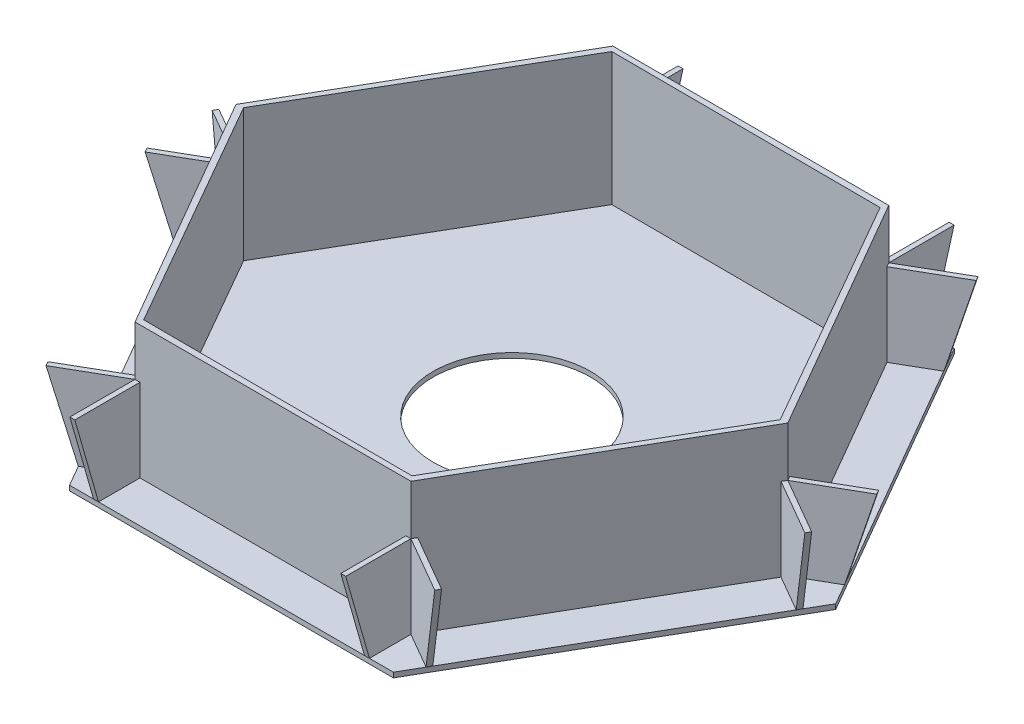
from build123d import *

# Parameters (mm, degrees)
EXTRUDE_2_DEPTH     = 3
SKETCH_4_R          = 47.5
CUT_EXTRUDE_1_DEPTH = 3
EXTRUDE_3_DEPTH     = 80
EXTRUDE_7_DEPTH     = 3
EXTRUDE_11_DEPTH    = 3
EXTRUDE_12_DEPTH    = 3
EXTRUDE_13_DEPTH    = 3
EXTRUDE_14_DEPTH    = 3
EXTRUDE_15_DEPTH    = 3
EXTRUDE_16_DEPTH    = 3
EXTRUDE_17_DEPTH    = 3
EXTRUDE_18_DEPTH    = 3
EXTRUDE_19_DEPTH    = 3
EXTRUDE_20_DEPTH    = 3
EXTRUDE_21_DEPTH    = 3


with BuildPart() as part:
    # 草图3 → 凸台-拉伸2 (new body)
    with BuildSketch(Plane(origin=(0, 0, 0), x_dir=(1, 0, 0), z_dir=(0, 1, 0))):
        Polygon((195.4, 0), (97.7, 169.221363899), (-97.7, 169.221363899), (-195.4, 0), (-97.7, -169.221363899), (97.7, -169.221363899), align=None)
    extrude(amount=EXTRUDE_2_DEPTH)

    # 草图4 → 切除-拉伸1 (cut)
    with BuildSketch(Plane(origin=(0, 3, 0), x_dir=(1, 0, 0), z_dir=(0, 1, 0))):
        with Locations(Location((0, 0, 0), (0, 0, 270))):
            Circle(SKETCH_4_R)
    extrude(amount=-CUT_EXTRUDE_1_DEPTH, mode=Mode.SUBTRACT)

    # 草图5 → 凸台-拉伸3 (add)
    with BuildSketch(Plane(origin=(0, 3, 0), x_dir=(1, 0, 0), z_dir=(0, 1, 0))):
        Polygon((83.24, 144.175909222), (-83.24, 144.175909222), (-166.48, 0), (-83.24, -144.175909222), (83.24, -144.175909222), (166.48, 0), align=None)
        Polygon((-80.729537332, 141.005291398), (-162.478933084, 0.588815534), (-81.749395753, -140.416475864), (80.729537332, -141.005291398), (162.478933084, -0.588815534), (81.749395753, 140.416475864), align=None, mode=Mode.SUBTRACT)
    extrude(amount=EXTRUDE_3_DEPTH)

    # 草图11 → 凸台-拉伸7 (add)
    with BuildSketch(Plane(origin=(83.24, 0, 0), x_dir=(0, 0, -1), z_dir=(1, 0, 0))):
        Polygon((144.175909222, 3), (144.175909222, 53), (183.582235223, 53), (169.299378366, 3), align=None)
    extrude(amount=-EXTRUDE_7_DEPTH)

    # 草图15 → 凸台-拉伸11 (add)
    with BuildSketch(Plane(origin=(-41.62, 0, -72.087954611), x_dir=(-0.8660254037844382, 0, 0.500000000000001), z_dir=(-0.500000000000001, 0, -0.8660254037844382))):
        Polygon((-144.175909222, 53), (-144.175909222, 3), (-169.299052365, 3), (-183.581909222, 53), align=None)
    extrude(amount=-EXTRUDE_11_DEPTH)

    # 草图17 → 凸台-拉伸12 (add)
    with BuildSketch(Plane(origin=(-41.62, 0, -72.087954611), x_dir=(-0.8660254037844382, 0, 0.500000000000001), z_dir=(-0.500000000000001, 0, -0.8660254037844382))):
        Polygon((144.175909222, 3), (169.221363899, 3), (183.504220757, 53), (144.175909222, 53), align=None)
    extrude(amount=-EXTRUDE_12_DEPTH)

    # 草图19 → 凸台-拉伸13 (add)
    with BuildSketch(Plane(origin=(83.24, 0, 0), x_dir=(0, 0, -1), z_dir=(1, 0, 0))):
        Polygon((-144.175909222, 3), (-144.175909222, 53), (-183.495909222, 53), (-169.213052365, 3), align=None)
    extrude(amount=-EXTRUDE_13_DEPTH)

    # 草图20 → 凸台-拉伸14 (add)
    with BuildSketch(Plane(origin=(-83.24, 0, 0), x_dir=(0, 0, -1), z_dir=(1, 0, 0))):
        Polygon((144.175909222, 3), (144.175909222, 53), (183.495909222, 53), (169.213052365, 3), align=None)
    extrude(amount=EXTRUDE_14_DEPTH)

    # 草图22 → 凸台-拉伸15 (add)
    with BuildSketch(Plane(origin=(-83.24, 0, 0), x_dir=(0, 0, -1), z_dir=(1, 0, 0))):
        Polygon((-144.175909222, 53), (-144.175909222, 3), (-169.213052365, 3), (-183.495909222, 53), align=None)
    extrude(amount=EXTRUDE_15_DEPTH)

    # 草图23 → 凸台-拉伸16 (add)
    with BuildSketch(Plane(origin=(-41.62, 0, 72.087954611), x_dir=(-0.8660254037844406, 0, -0.4999999999999966), z_dir=(0.4999999999999966, 0, -0.8660254037844406))):
        Polygon((-144.175909222, 53), (-144.175909222, 3), (-169.091328291, 3), (-183.495909222, 52.96506828), align=None)
    extrude(amount=EXTRUDE_16_DEPTH)

    # 草图24 → 凸台-拉伸17 (add)
    with BuildSketch(Plane(origin=(41.62, 0, -72.087954611), x_dir=(-0.866025403784439, 0, -0.4999999999999994), z_dir=(0.4999999999999994, 0, -0.866025403784439))):
        Polygon((-144.175909222, 3), (-169.213052365, 3), (-183.495909222, 53), (-144.175909222, 53), align=None)
    extrude(amount=-EXTRUDE_17_DEPTH)

    # 草图26 → 凸台-拉伸18 (add)
    with BuildSketch(Plane(origin=(-41.62, 0, 72.087954611), x_dir=(-0.8660254037844406, 0, -0.4999999999999966), z_dir=(0.4999999999999966, 0, -0.8660254037844406))):
        Polygon((144.175909222, 53), (144.175909222, 3), (169.213052365, 3), (183.495909222, 53), align=None)
    extrude(amount=EXTRUDE_18_DEPTH)

    # 草图27 → 凸台-拉伸19 (add)
    with BuildSketch(Plane(origin=(41.62, 0, -72.087954611), x_dir=(-0.866025403784439, 0, -0.4999999999999994), z_dir=(0.4999999999999994, 0, -0.866025403784439))):
        Polygon((144.175909222, 53), (144.175909222, 3), (169.137463214, 3), (183.495909222, 52.978345593), align=None)
    extrude(amount=-EXTRUDE_19_DEPTH)

    # 草图28 → 凸台-拉伸20 (add)
    with BuildSketch(Plane(origin=(41.62, 0, 72.087954611), x_dir=(-0.8660254037844407, 0, 0.4999999999999965), z_dir=(-0.4999999999999965, -1.145624345781526e-15, -0.8660254037844407))):
        Polygon((144.175909222, 53), (144.175909222, 3), (169.213052365, 3), (183.495909222, 53), align=None)
    extrude(amount=EXTRUDE_20_DEPTH)

    # 草图31 → 凸台-拉伸21 (add)
    with BuildSketch(Plane(origin=(41.62, 0, 72.087954611), x_dir=(-0.8660254037844407, 0, 0.4999999999999965), z_dir=(-0.4999999999999965, -1.145624345781526e-15, -0.8660254037844407))):
        Polygon((-144.175909222, 53), (-144.175909222, 3), (-169.213052365, 3), (-183.495909222, 53), align=None)
    extrude(amount=EXTRUDE_21_DEPTH)


solid = part.part
